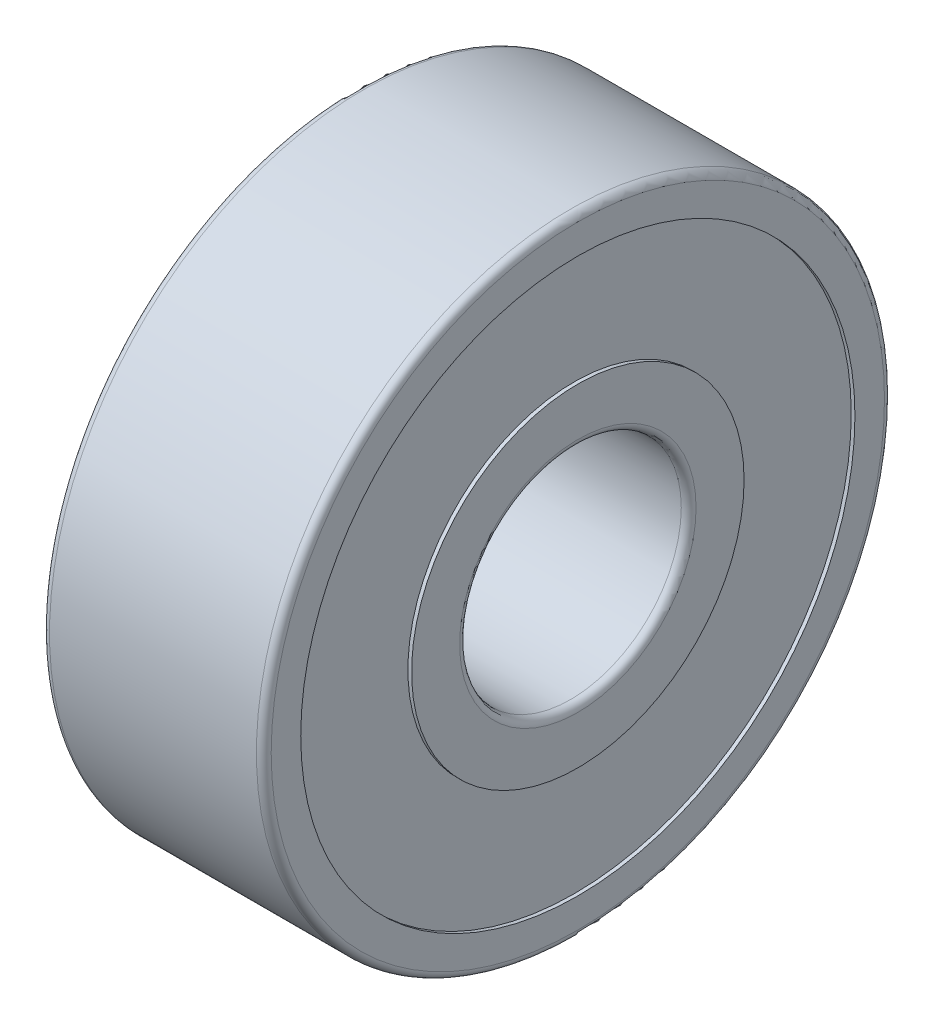
from build123d import *

# Parameters (mm, degrees)
SKETCH1_R           = 8.5
SKETCH1_R_2         = 3
BOSS_EXTRUDE1_DEPTH = 6
SKETCH2_R           = 7.5
SKETCH2_R_2         = 4.5
CUT_EXTRUDE1_DEPTH  = 0.1
CUT_EXTRUDE2_START  = -0.1
SKETCH3_R           = 7.5
SKETCH3_R_2         = 4.5
CUT_EXTRUDE2_DEPTH  = 0.1
FILLET1_R           = 0.2


with BuildPart() as part:
    # Sketch1 → Boss-Extrude1 (new body)
    with BuildSketch(Plane(origin=(0, 0, 0), x_dir=(0, 0, -1), z_dir=(1, 0, 0))):
        Circle(SKETCH1_R)
        Circle(SKETCH1_R_2, mode=Mode.SUBTRACT)
    extrude(amount=BOSS_EXTRUDE1_DEPTH)

    # Sketch2 → Cut-Extrude1 (cut)
    with BuildSketch(Plane(origin=(6, 0, 0), x_dir=(0, 0, -1), z_dir=(1, 0, 0))):
        Circle(SKETCH2_R)
        Circle(SKETCH2_R_2, mode=Mode.SUBTRACT)
    extrude(amount=-CUT_EXTRUDE1_DEPTH, mode=Mode.SUBTRACT)

    # Sketch3 → Cut-Extrude2 (cut)
    with BuildSketch(Plane.ZY.offset(CUT_EXTRUDE2_START)):
        with Locations(Location((0, 0, 0), (0, 0, 180))):
            Circle(SKETCH3_R)
        with Locations(Location((0, 0, 0), (0, 0, 180))):
            Circle(SKETCH3_R_2, mode=Mode.SUBTRACT)
    extrude(amount=CUT_EXTRUDE2_DEPTH, mode=Mode.SUBTRACT)

    # Fillet1
    fillet1_edges = [part.edges().sort_by_distance(p)[0] for p in [
        (0, 0, 8.5),
        (6, 0, 8.5),
        (0, 0, 3),
        (6, 0, 3),
    ]]
    fillet(fillet1_edges, radius=FILLET1_R)


solid = part.part
